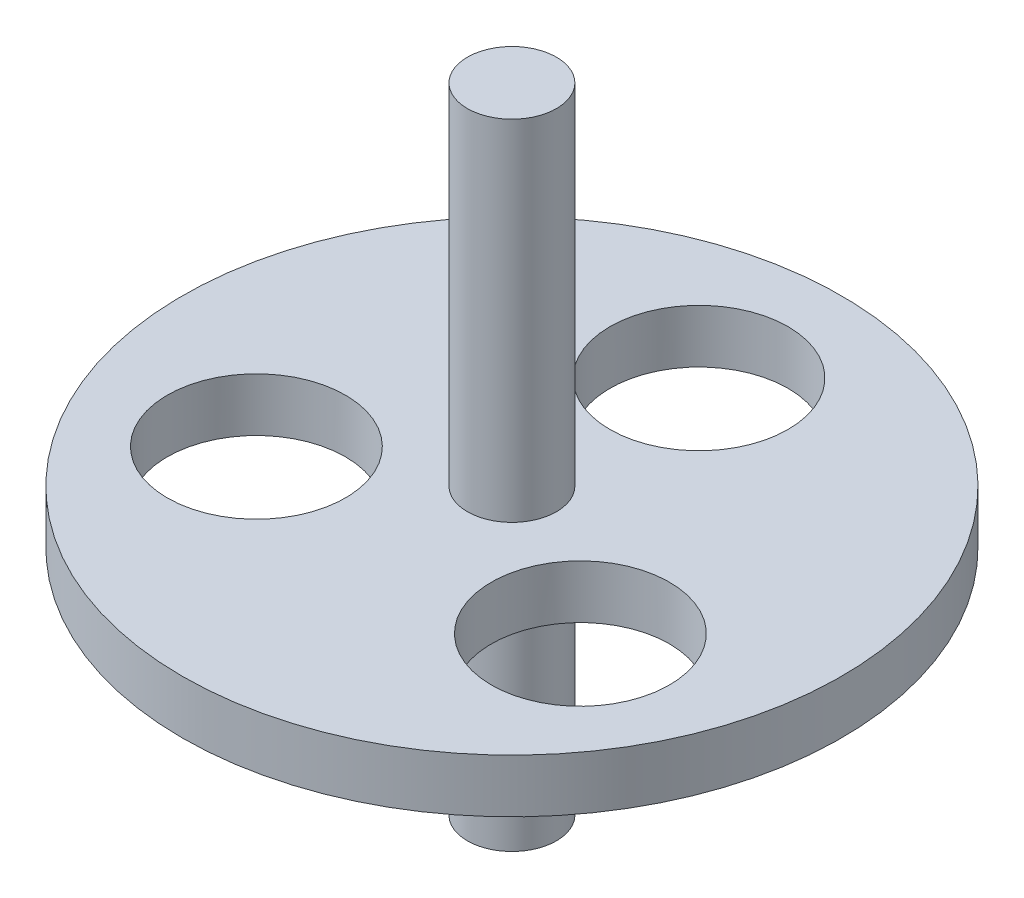
from build123d import *

# Parameters (mm, degrees)
SKETCH_1_R               = 18.5
EXTRUDE_1_DEPTH          = 3
SKETCH_2_R               = 2.5
EXTRUDE_2_DEPTH          = 19.6
EXTRUDE_START            = 13
SKETCH_3_R               = 2.5
EXTRUDE_3_DEPTH          = 13
CUT_EXTRUDE_1_REACH      = 36.573
SKETCH_4_R               = 5
PATTERN_CIRCULAR_1_COUNT = 3


with BuildPart() as part:
    # 草图1 → 凸台-拉伸1 (new body)
    with BuildSketch(Plane(origin=(0, 0, 0), x_dir=(1, 0, 0), z_dir=(0, 1, 0))):
        with Locations(Location((0, 0, 0), (0, 0, 270))):
            Circle(SKETCH_1_R)
    extrude(amount=EXTRUDE_1_DEPTH)

    # 草图2 → 凸台-拉伸2 (add)
    with BuildSketch(Plane(origin=(0, 3, 0), x_dir=(1, 0, 0), z_dir=(0, 1, 0))):
        with Locations(Location((0, 0, 0), (0, 0, 270))):
            Circle(SKETCH_2_R)
    extrude(amount=EXTRUDE_2_DEPTH)

    # 草图3 → 凸台-拉伸3 (add)
    with BuildSketch(Plane(origin=(0, 0, 0), x_dir=(-1, 0, 0), z_dir=(0, -1, 0)).offset(EXTRUDE_START)):
        with Locations(Location((0, 0, 0), (0, 0, 270))):
            Circle(SKETCH_3_R)
    extrude(amount=-EXTRUDE_3_DEPTH)

    # 草图4 → 切除-拉伸1 (cut, up to next)
    with BuildSketch(Plane(origin=(0, 0, 0), x_dir=(-1, 0, 0), z_dir=(0, -1, 0)), mode=Mode.PRIVATE) as cut_extrude_1_sk1:
        with Locations(Location((0, 10.5, 0), (0, 0, 90))):
            Circle(SKETCH_4_R)
    cut_extrude_1_tool1 = extrude(cut_extrude_1_sk1.sketch, amount=-CUT_EXTRUDE_1_REACH, mode=Mode.PRIVATE) & part.part
    cut_extrude_1 = cut_extrude_1_tool1.solids().sort_by_distance((0, 0, -10.5))[0]
    add(cut_extrude_1, mode=Mode.SUBTRACT)

    # 阵列(圆周)1: 切除-拉伸1 ×3 about axis
    pattern_circular_1_axis = Axis((0, 0, 0), (0, 1, 0))
    for i in range(1, PATTERN_CIRCULAR_1_COUNT):
        add(cut_extrude_1.rotate(pattern_circular_1_axis, i * 360 / PATTERN_CIRCULAR_1_COUNT), mode=Mode.SUBTRACT)


solid = part.part
